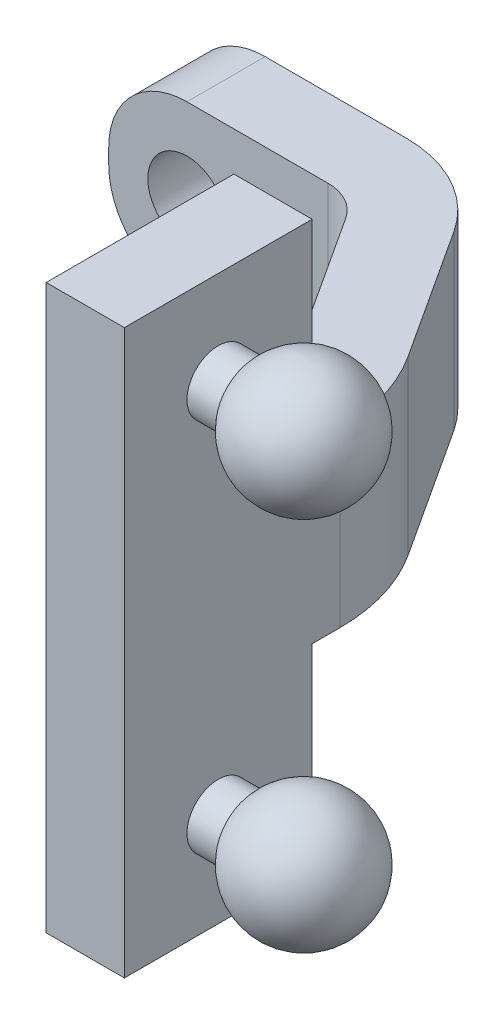
from build123d import *

# Parameters (mm, degrees)
EXTRUDE_1_DEPTH     = 2.75
SKETCH_2_R          = 1.25
CUT_EXTRUDE_1_DEPTH = 10
FILLET_2_R          = 2.5
SKETCH_4_W          = 6
SKETCH_4_H          = 18
EXTRUDE_2_DEPTH     = 2.5
SKETCH_5_R          = 1
EXTRUDE_3_DEPTH     = 1


with BuildPart() as part:
    # 草图1 → 凸台-拉伸1 (new, symmetric)
    with BuildSketch(Plane(origin=(0, 0, 0), x_dir=(1, 0, 0), z_dir=(0, 1, 0))):
        with BuildLine():
            Line((0, 0), (7, 0))
            ThreePointArc((7, 0), (8.907645559, -0.484194485), (10.353455389, -1.819555789))
            Line((10.353455389, -1.819555789), (13.08620622, -6.022441585))
            ThreePointArc((13.08620622, -6.022441585), (13.76673936, -7.496994372), (14, -9.104172255))
            Line((14, -9.104172255), (14, -16))
            Line((14, -16), (11.5, -16))
            Line((11.5, -16), (11.5, -9.104172255))
            ThreePointArc((11.5, -9.104172255), (11.369889965, -8.207707378), (10.990296602, -7.385219216))
            Line((10.990296602, -7.385219216), (8.257545771, -3.182333421))
            ThreePointArc((8.257545771, -3.182333421), (7.715367085, -2.681572932), (7, -2.5))
            Line((7, -2.5), (0, -2.5))
            Line((0, -2.5), (0, 0))
        make_face()
    extrude(amount=EXTRUDE_1_DEPTH, both=True)

    # 草图2 → 切除-拉伸1 (cut)
    with BuildSketch(Plane(origin=(0, 0, 0), x_dir=(-1, 0, 0), z_dir=(0, 0, -1))):
        with Locations((-2.5, 0)):
            Circle(SKETCH_2_R)
    extrude(amount=-CUT_EXTRUDE_1_DEPTH, mode=Mode.SUBTRACT)

    # 圆角2
    fillet_2_edges = [part.edges().sort_by_distance(p)[0] for p in [
        (0, -2.75, 1.25),
        (0, 2.75, 1.25),
    ]]
    fillet(fillet_2_edges, radius=FILLET_2_R)

    # 草图4 → 凸台-拉伸2 (add)
    with BuildSketch(Plane.ZY.offset(-11.5)):
        with Locations((13, 0)):
            Rectangle(SKETCH_4_W, SKETCH_4_H)
    extrude(amount=-EXTRUDE_2_DEPTH)

    # 草图5 → 凸台-拉伸3 (add)
    with BuildSketch(Plane(origin=(14, 0, 0), x_dir=(0, 0, -1), z_dir=(1, 0, 0))):
        with Locations(Location((-13, 6, 0), (0, 0, 180))):
            Circle(SKETCH_5_R)
    extrude_3 = extrude(amount=EXTRUDE_3_DEPTH)

    # 草图6 → 旋转1 (revolve)
    with BuildSketch(Plane(origin=(0, 0, 13), x_dir=(-1, 0, 0), z_dir=(0, 0, -1))):
        with BuildLine():
            Line((-15, 6), (-18.732050808, 6))
            ThreePointArc((-18.732050808, 6), (-17.249688898, 7.931851653), (-15, 7))
            Line((-15, 7), (-15, 6))
        make_face()
    revolve_1 = revolve(axis=Axis((15, 6, 13), (1, 0, 0)))

    # 镜向1: 凸台-拉伸3, 旋转1 across plane
    add(extrude_3.mirror(Plane.ZX))
    add(revolve_1.mirror(Plane.ZX))


solid = part.part
